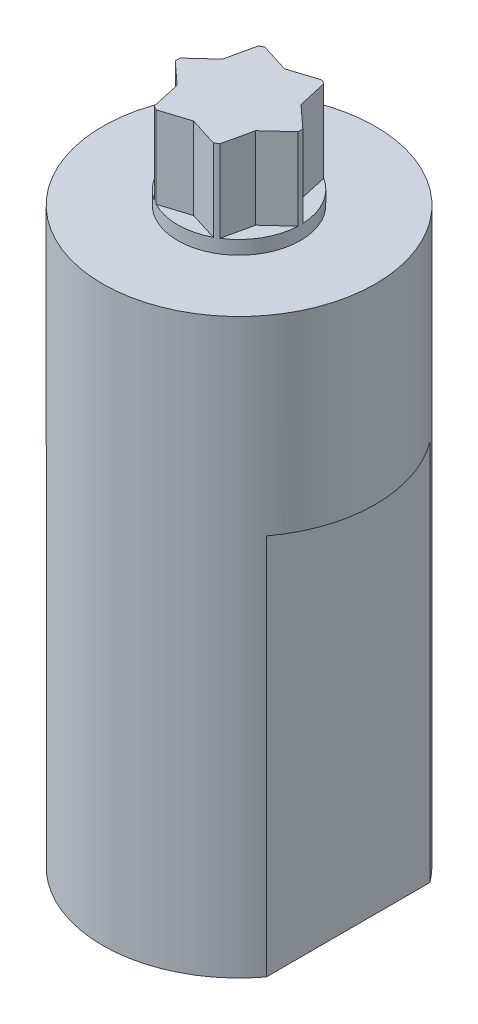
from build123d import *

# Parameters (mm, degrees)
SKETCH1_R           = 5
BOSS_EXTRUDE1_DEPTH = 7
BOSS_EXTRUDE2_START = -14
BOSS_EXTRUDE2_DEPTH = 14
SKETCH3_R           = 2.25
BOSS_EXTRUDE3_DEPTH = 3.5
CUT_EXTRUDE1_DEPTH  = 3
CIRPATTERN1_COUNT   = 6


with BuildPart() as part:
    # Sketch1 → Boss-Extrude1 (new body)
    with BuildSketch(Plane(origin=(0, 0, 0), x_dir=(1, 0, 0), z_dir=(0, 1, 0))):
        with Locations(Location((0, 0, 0), (0, 0, 270))):
            Circle(SKETCH1_R)
    extrude(amount=BOSS_EXTRUDE1_DEPTH)

    # Sketch2 → Boss-Extrude2 (add)
    with BuildSketch(Plane(origin=(0, 0, 0), x_dir=(1, 0, 0), z_dir=(0, 1, 0)).offset(BOSS_EXTRUDE2_START)):
        with BuildLine():
            Line((4, -3), (4, 3))
            ThreePointArc((4, 3), (0, 5), (-4, 3))
            Line((-4, 3), (-4, -3))
            ThreePointArc((-4, -3), (0, -5), (4, -3))
        make_face()
    extrude(amount=BOSS_EXTRUDE2_DEPTH)

    # Sketch3 → Boss-Extrude3 (add)
    with BuildSketch(Plane(origin=(0, 7, 0), x_dir=(1, 0, 0), z_dir=(0, 1, 0))):
        with Locations(Location((0, 0, 0), (0, 0, 270))):
            Circle(SKETCH3_R)
    extrude(amount=BOSS_EXTRUDE3_DEPTH)

    # Sketch4 → Cut-Extrude1 (cut)
    with BuildSketch(Plane(origin=(0, 10.5, 0), x_dir=(1, 0, 0), z_dir=(0, 1, 0))):
        Polygon((0, 1.662498522), (-5.909749561, 3.521754474), (5.909749561, 3.521754474), align=None)
    cut_extrude1 = extrude(amount=-CUT_EXTRUDE1_DEPTH, mode=Mode.SUBTRACT)

    # CirPattern1: Cut-Extrude1 ×6 about axis
    cirpattern1_axis = Axis((0, 0, 0), (0, 1, 0))
    for i in range(1, CIRPATTERN1_COUNT):
        add(cut_extrude1.rotate(cirpattern1_axis, i * 360 / CIRPATTERN1_COUNT), mode=Mode.SUBTRACT)


solid = part.part
